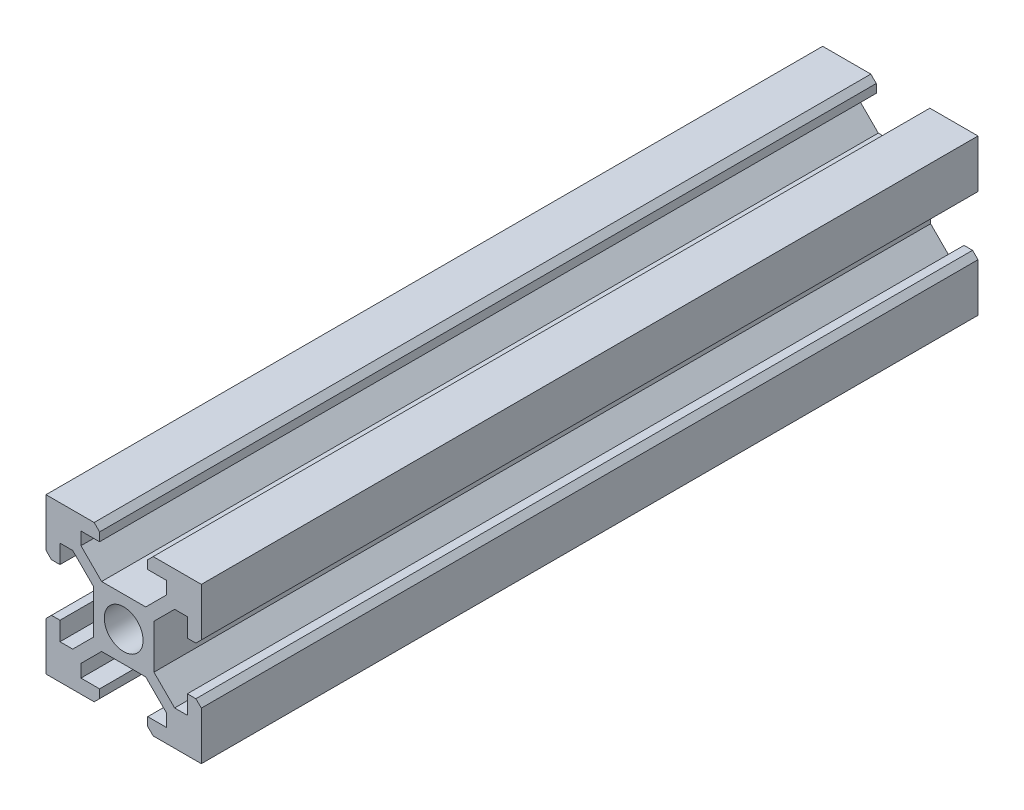
from build123d import *

# Parameters (mm, degrees)
SKETCH1_R           = 2.5
BOSS_EXTRUDE1_DEPTH = 50


with BuildPart() as part:
    # Sketch1 → Boss-Extrude1 (new, symmetric)
    with BuildSketch(Plane.XY):
        Polygon((3.9, -2.839339828), (6.560660172, -5.5), (8.200660172, -5.5), (8.200660172, -3.1), (9.3, -3.1), (10, -3.8), (10, -10), (3.8, -10), (3.1, -9.3), (3.1, -8.200660172), (5.5, -8.200660172), (5.5, -6.560660172), (2.839339828, -3.9), (-2.839339828, -3.9), (-5.5, -6.560660172), (-5.5, -8.200660172), (-3.1, -8.200660172), (-3.1, -9.3), (-3.8, -10), (-10, -10), (-10, -3.8), (-9.3, -3.1), (-8.200660172, -3.1), (-8.200660172, -5.5), (-6.560660172, -5.5), (-3.9, -2.839339828), (-3.9, 2.839339828), (-6.560660172, 5.5), (-8.200660172, 5.5), (-8.200660172, 3.1), (-9.3, 3.1), (-10, 3.8), (-10, 10), (-3.8, 10), (-3.1, 9.3), (-3.1, 8.200660172), (-5.5, 8.200660172), (-5.5, 6.560660172), (-2.839339828, 3.9), (2.839339828, 3.9), (5.5, 6.560660172), (5.5, 8.200660172), (3.1, 8.200660172), (3.1, 9.3), (3.8, 10), (10, 10), (10, 3.8), (9.3, 3.1), (8.200660172, 3.1), (8.200660172, 5.5), (6.560660172, 5.5), (3.9, 2.839339828), align=None)
        Circle(SKETCH1_R, mode=Mode.SUBTRACT)
    extrude(amount=BOSS_EXTRUDE1_DEPTH, both=True)


solid = part.part
